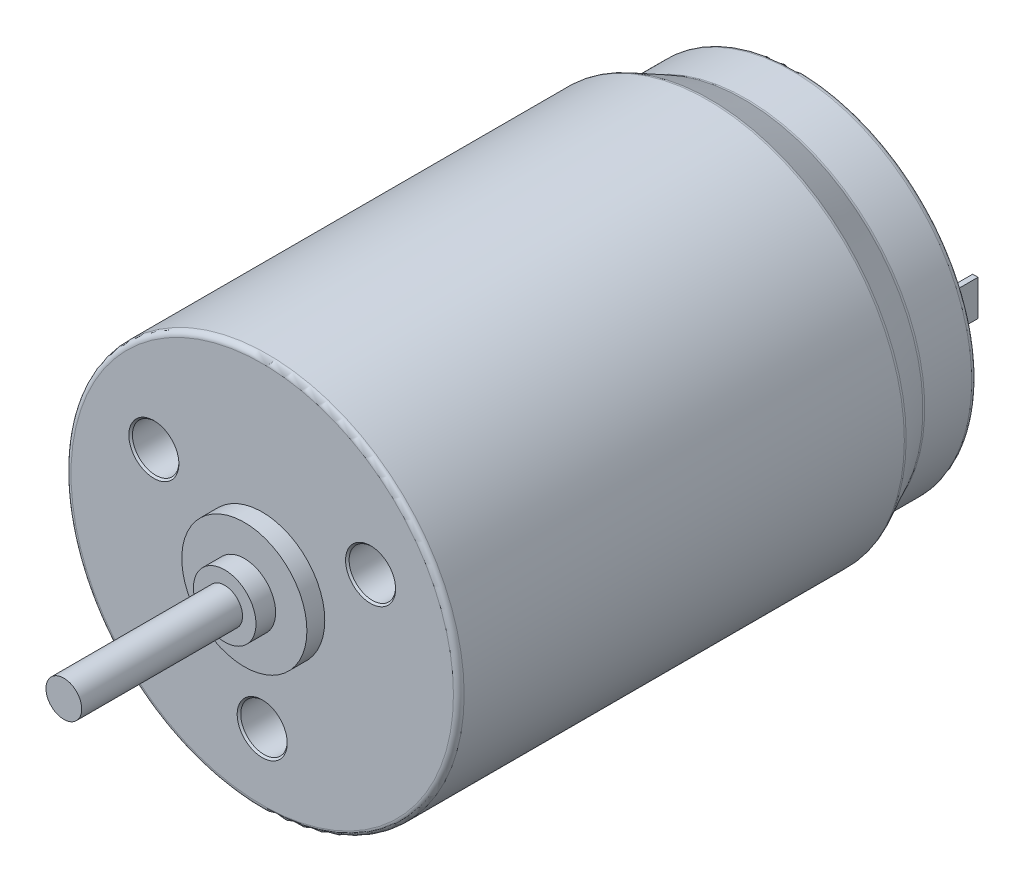
from build123d import *

# Parameters (mm, degrees)
SKETCH1_R           = 11
BOSS_EXTRUDE1_DEPTH = 25
SKETCH2_R           = 10
SKETCH3_R           = 10
BOSS_EXTRUDE2_DEPTH = 3
SKETCH4_R           = 1.3
CUT_EXTRUDE1_DEPTH  = 5
CHAMFER1_SIZE       = 0.1
SKETCH5_R           = 3.5
BOSS_EXTRUDE3_DEPTH = 1
SKETCH6_R           = 1.75
BOSS_EXTRUDE4_DEPTH = 1.1
SKETCH7_R           = 1
BOSS_EXTRUDE5_DEPTH = 9
SKETCH8_W           = 0.3
SKETCH8_H           = 2
BOSS_EXTRUDE6_DEPTH = 3.9
FILLET1_R           = 0.3


with BuildPart() as part:
    # Sketch1 → Boss-Extrude1 (new body)
    with BuildSketch(Plane.XY):
        Circle(SKETCH1_R)
    extrude(amount=-BOSS_EXTRUDE1_DEPTH)

    # Sketch2 → section 1 of loft1
    with BuildSketch(Plane(origin=(0, 0, -27), x_dir=(-1, 0, 0), z_dir=(0, 0, -1)), mode=Mode.PRIVATE) as loft1_s1:
        Circle(SKETCH2_R)
    # loft from a face of the part (loft1)
    loft([part.faces().sort_by_distance((0, 0, -25))[0], loft1_s1.sketch])

    # Sketch3 → Boss-Extrude2 (add)
    with BuildSketch(Plane(origin=(0, 0, -27), x_dir=(-1, 0, 0), z_dir=(0, 0, -1))):
        Circle(SKETCH3_R)
    extrude(amount=BOSS_EXTRUDE2_DEPTH)

    # Sketch4 → Cut-Extrude1 (cut)
    with BuildSketch(Plane.XY):
        with Locations((-6.062177826, 3.5)):
            Circle(SKETCH4_R)
        with Locations((6.062177826, 3.5)):
            Circle(SKETCH4_R)
        with Locations((0, -7)):
            Circle(SKETCH4_R)
    extrude(amount=-CUT_EXTRUDE1_DEPTH, mode=Mode.SUBTRACT)

    # Chamfer1
    chamfer1_edges = [part.edges().sort_by_distance(p)[0] for p in [
        (-7.362177826, 3.5, 0),
        (4.762177826, 3.5, 0),
        (-1.3, -7, 0),
    ]]
    chamfer(chamfer1_edges, length=CHAMFER1_SIZE)

    # Sketch5 → Boss-Extrude3 (add)
    with BuildSketch(Plane.XY):
        Circle(SKETCH5_R)
    extrude(amount=BOSS_EXTRUDE3_DEPTH)

    # Sketch6 → Boss-Extrude4 (add)
    with BuildSketch(Plane.XY.offset(1)):
        Circle(SKETCH6_R)
    extrude(amount=BOSS_EXTRUDE4_DEPTH)

    # Sketch7 → Boss-Extrude5 (add)
    with BuildSketch(Plane.XY.offset(2.1)):
        Circle(SKETCH7_R)
    extrude(amount=BOSS_EXTRUDE5_DEPTH)

    # Sketch8 → Boss-Extrude6 (add)
    with BuildSketch(Plane(origin=(0, 0, -30), x_dir=(-1, 0, 0), z_dir=(0, 0, -1))):
        with Locations((-6, 0)):
            Rectangle(SKETCH8_W, SKETCH8_H)
        with Locations((6, 0)):
            Rectangle(SKETCH8_W, SKETCH8_H)
    extrude(amount=BOSS_EXTRUDE6_DEPTH)

    # Fillet1
    fillet1_edges = [part.edges().sort_by_distance(p)[0] for p in [
        (10, 0, -30),
        (-11, 0, 0),
        (0, 10, -27),
        (-11, 0, -25),
    ]]
    fillet(fillet1_edges, radius=FILLET1_R)


solid = part.part
